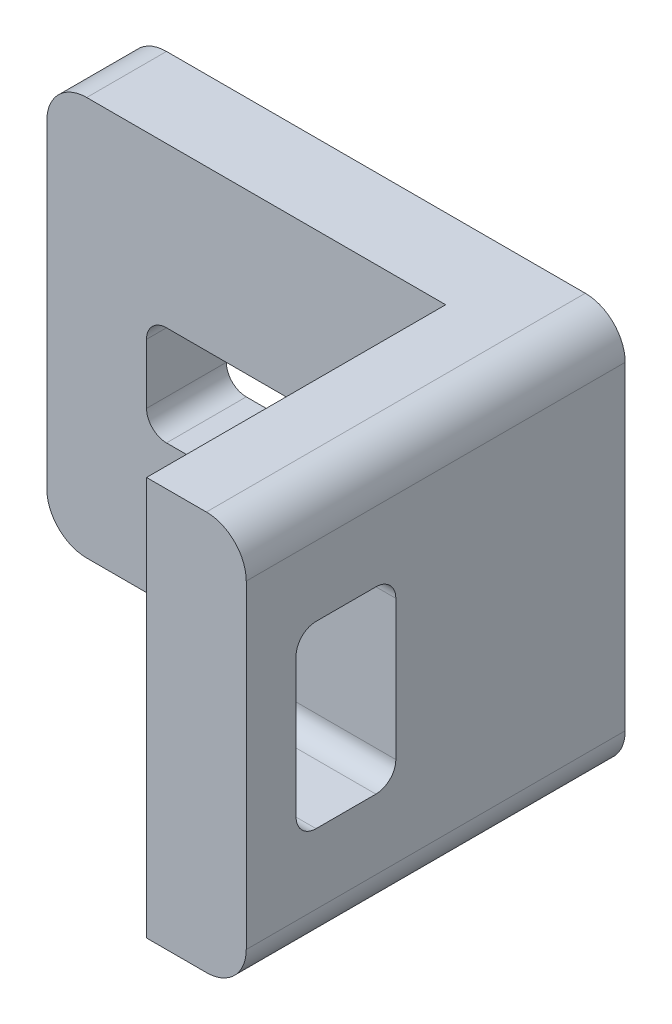
from build123d import *

# Parameters (mm, degrees)
BOSS_EXTRU_1_DEPTH      = 4
BOSS_EXTRU_3_DEPTH      = 15
ENL_V_MAT_EXTRU_1_DEPTH = 50
ENL_V_MAT_EXTRU_2_DEPTH = 50


with BuildPart() as part:
    # Esquisse1 → Boss.-Extru.1 (new body)
    with BuildSketch(Plane.XY):
        with BuildLine():
            Line((-11.273273273, 8.708708709), (9.726726727, 8.708708709))
            ThreePointArc((9.726726727, 8.708708709), (11.140940289, 8.122922271), (11.726726727, 6.708708709))
            Line((11.726726727, 6.708708709), (11.726726727, -9.291291291))
            ThreePointArc((11.726726727, -9.291291291), (11.140940289, -10.705504854), (9.726726727, -11.291291291))
            Line((9.726726727, -11.291291291), (-11.273273273, -11.291291291))
            ThreePointArc((-11.273273273, -11.291291291), (-12.687486836, -10.705504854), (-13.273273273, -9.291291291))
            Line((-13.273273273, -9.291291291), (-13.273273273, 6.708708709))
            ThreePointArc((-13.273273273, 6.708708709), (-12.687486836, 8.122922271), (-11.273273273, 8.708708709))
        make_face()
    extrude(amount=BOSS_EXTRU_1_DEPTH)

    # Esquisse2 → Boss.-Extru.3 (add)
    with BuildSketch(Plane.XY.offset(4)):
        with BuildLine():
            Line((6.726726727, 8.708708709), (9.726726727, 8.708708709))
            ThreePointArc((9.726726727, 8.708708709), (11.140940289, 8.122922271), (11.726726727, 6.708708709))
            Line((11.726726727, 6.708708709), (11.726726727, -9.291291291))
            ThreePointArc((11.726726727, -9.291291291), (11.140940289, -10.705504854), (9.726726727, -11.291291291))
            Line((9.726726727, -11.291291291), (6.726726727, -11.291291291))
            Line((6.726726727, -11.291291291), (6.726726727, 8.708708709))
        make_face()
    extrude(amount=BOSS_EXTRU_3_DEPTH)

    # Esquisse3 → Enlèv. mat.-Extru.1 (cut)
    with BuildSketch(Plane.XY.offset(4)):
        with BuildLine():
            Line((-7.273273273, 0.708708709), (-0.273273273, 0.708708709))
            ThreePointArc((-0.273273273, 0.708708709), (0.433833508, 0.41581549), (0.726726727, -0.291291291))
            Line((0.726726727, -0.291291291), (0.726726727, -3.291291291))
            ThreePointArc((0.726726727, -3.291291291), (0.433833508, -3.998398072), (-0.273273273, -4.291291291))
            Line((-0.273273273, -4.291291291), (-7.273273273, -4.291291291))
            ThreePointArc((-7.273273273, -4.291291291), (-7.980380054, -3.998398072), (-8.273273273, -3.291291291))
            Line((-8.273273273, -3.291291291), (-8.273273273, -0.291291291))
            ThreePointArc((-8.273273273, -0.291291291), (-7.980380054, 0.41581549), (-7.273273273, 0.708708709))
        make_face()
    extrude(amount=-ENL_V_MAT_EXTRU_1_DEPTH, mode=Mode.SUBTRACT)

    # Esquisse4 → Enlèv. mat.-Extru.2 (cut)
    with BuildSketch(Plane.ZY.offset(-6.726726727)):
        with BuildLine():
            Line((12.5, 3.208708709), (15.5, 3.208708709))
            ThreePointArc((15.5, 3.208708709), (16.207106781, 2.91581549), (16.5, 2.208708709))
            Line((16.5, 2.208708709), (16.5, -4.791291291))
            ThreePointArc((16.5, -4.791291291), (16.207106781, -5.498398072), (15.5, -5.791291291))
            Line((15.5, -5.791291291), (12.5, -5.791291291))
            ThreePointArc((12.5, -5.791291291), (11.792893219, -5.498398072), (11.5, -4.791291291))
            Line((11.5, -4.791291291), (11.5, 2.208708709))
            ThreePointArc((11.5, 2.208708709), (11.792893219, 2.91581549), (12.5, 3.208708709))
        make_face()
    extrude(amount=-ENL_V_MAT_EXTRU_2_DEPTH, mode=Mode.SUBTRACT)


solid = part.part
